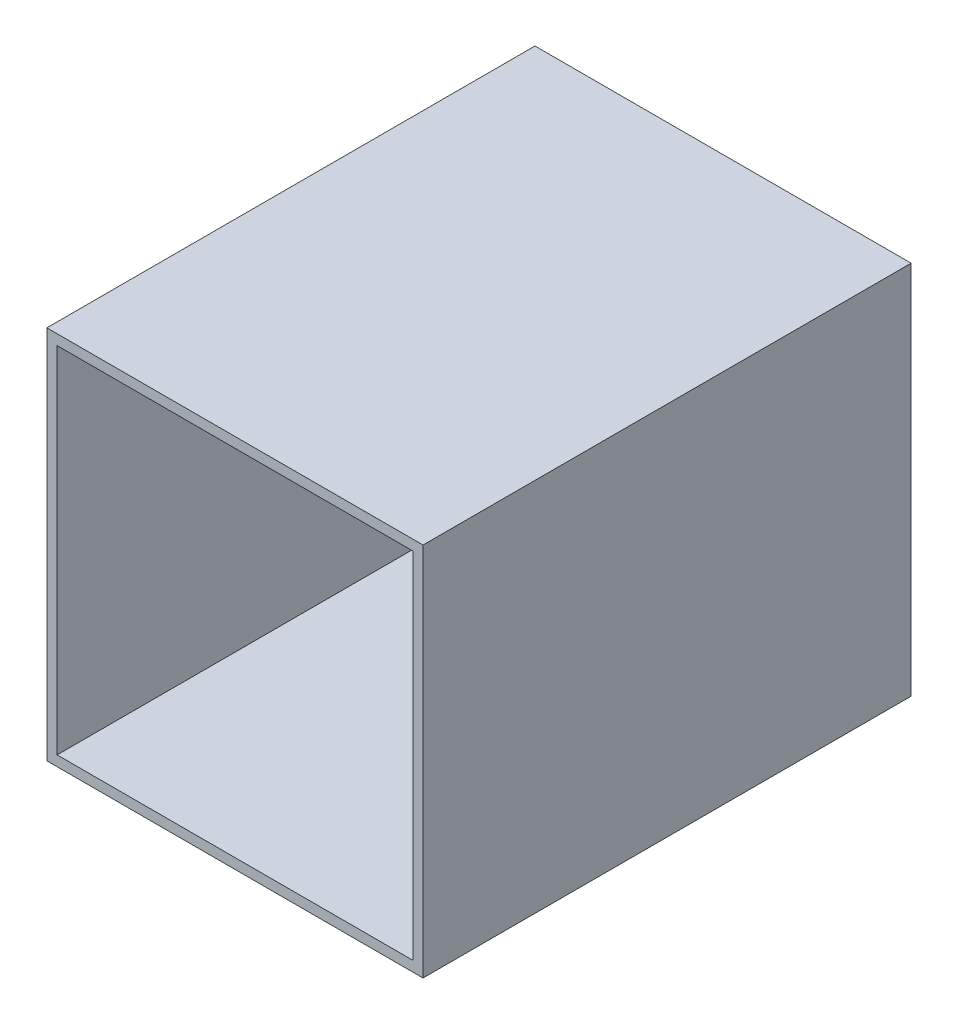
from build123d import *

# Parameters (mm, degrees)
CROQUIS1_W              = 157.6
CROQUIS1_H              = 157.1
CROQUIS1_W_2            = 149
CROQUIS1_H_2            = 148.5
SALIENTE_EXTRUIR1_DEPTH = 204.5
CROQUIS2_W              = 4
CROQUIS2_H              = 157.1
SALIENTE_EXTRUIR2_DEPTH = 149
CROQUIS3_R              = 11
CORTAR_EXTRUIR1_DEPTH   = 4.3


with BuildPart() as part:
    # Croquis1 → Saliente-Extruir1 (new body)
    with BuildSketch(Plane.XY):
        Rectangle(CROQUIS1_W, CROQUIS1_H)
        Rectangle(CROQUIS1_W_2, CROQUIS1_H_2, mode=Mode.SUBTRACT)
    extrude(amount=SALIENTE_EXTRUIR1_DEPTH)

    # Croquis2 → Saliente-Extruir2 (add)
    with BuildSketch(Plane(origin=(-74.5, 0, 0), x_dir=(0, 0, -1), z_dir=(1, 0, 0))):
        with Locations((-2, 0)):
            Rectangle(CROQUIS2_W, CROQUIS2_H)
    extrude(amount=SALIENTE_EXTRUIR2_DEPTH)

    # Croquis3 → Cortar-Extruir1 (cut)
    with BuildSketch(Plane.XZ.offset(78.55)):
        with Locations(Location((0, 34, 0), (0, 0, 270))):
            Circle(CROQUIS3_R)
    extrude(amount=-CORTAR_EXTRUIR1_DEPTH, mode=Mode.SUBTRACT)


solid = part.part
